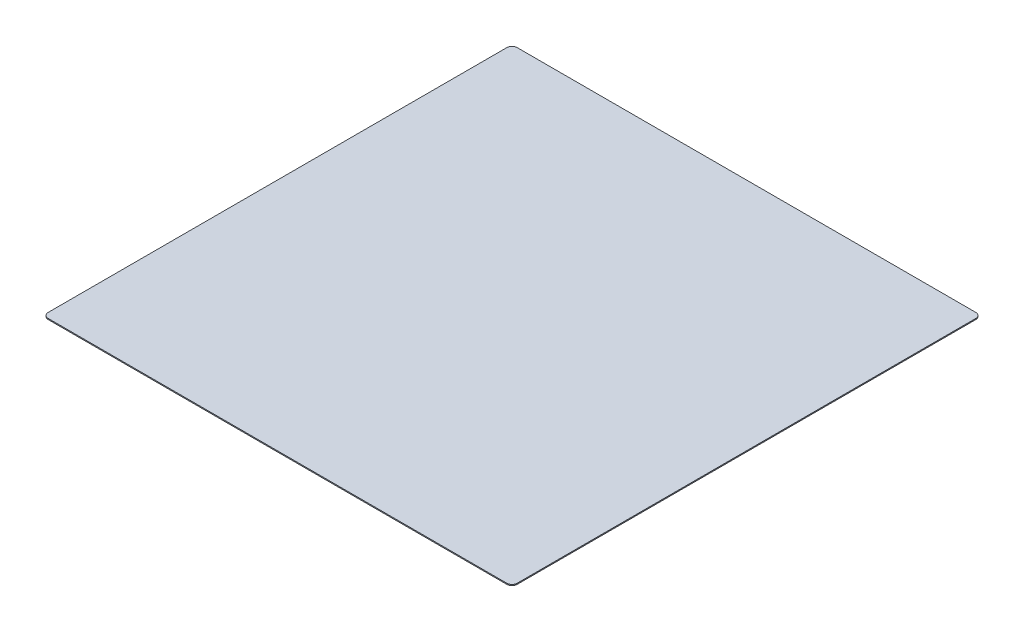
from build123d import *

# Parameters (mm, degrees)
SKETCH1_W           = 136.699999904
SKETCH1_H           = 136.699999904
BOSS_EXTRUDE1_DEPTH = 0.15
FILLET1_R           = 1.5


with BuildPart() as part:
    # Sketch1 → Boss-Extrude1 (new, symmetric)
    with BuildSketch(Plane(origin=(0, 0, 0), x_dir=(1, 0, 0), z_dir=(0, 1, 0))):
        Rectangle(SKETCH1_W, SKETCH1_H)
    extrude(amount=BOSS_EXTRUDE1_DEPTH, both=True)

    # Fillet1
    fillet1_edges = [part.edges().sort_by_distance(p)[0] for p in [
        (68.349999952, 0, 68.349999952),
        (-68.349999952, 0, 68.349999952),
        (-68.349999952, 0, -68.349999952),
        (68.349999952, 0, -68.349999952),
    ]]
    fillet(fillet1_edges, radius=FILLET1_R)


solid = part.part
